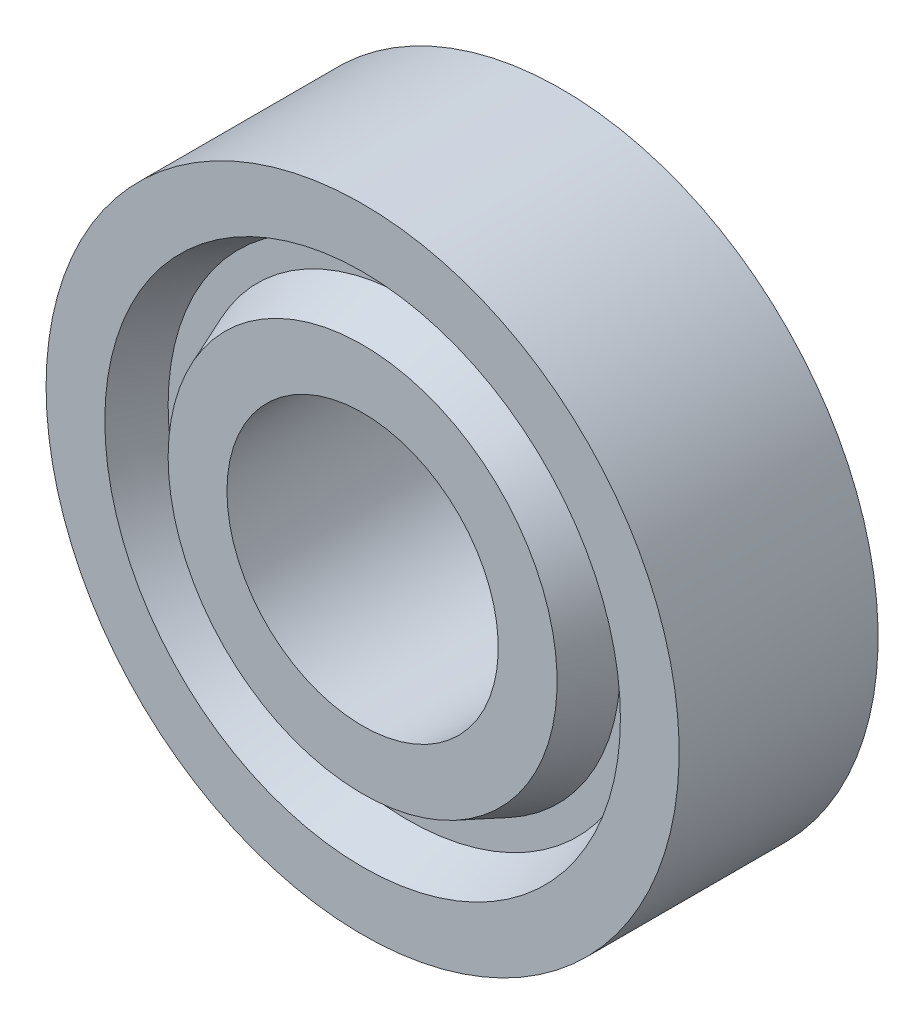
from build123d import *


with BuildPart() as part:
    # Sketch1 → Revolve1 (revolve)
    with BuildSketch(Plane(origin=(0, 0, 0), x_dir=(1, 0, 0), z_dir=(0, 1, 0)), mode=Mode.PRIVATE) as revolve1_sk:
        Polygon((10.753, 5.5), (11.753, 3), (13.253, 3), (14.253, 5.5), (17.5, 5.5), (17.5, -5.5), (14.253, -5.5), (13.253, -3), (11.753, -3), (10.753, -5.5), (7.5, -5.5), (7.5, 5.5), align=None)
    revolve(revolve1_sk.sketch.rotate(Axis((0, 0, -28.911106653), (0, 0, 1)), 180), axis=Axis((0, 0, -28.911106653), (0, 0, 1)))


solid = part.part
